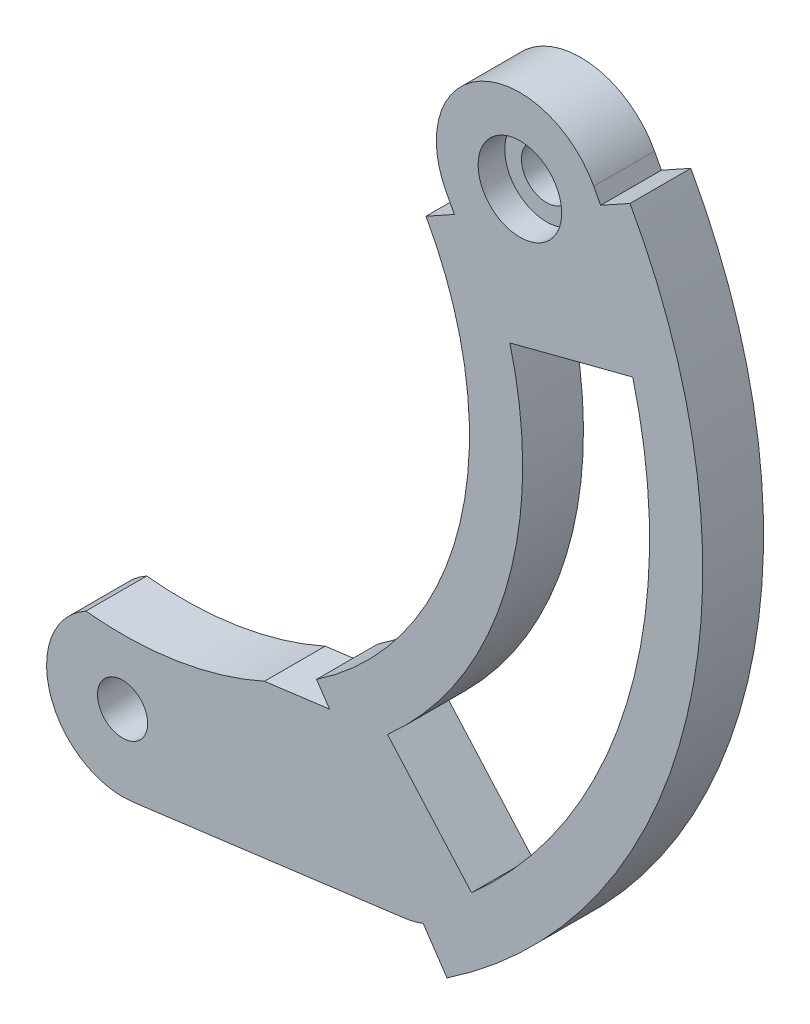
from build123d import *

# Parameters (mm, degrees)
F_01_EIGHT_MILLIMETRE_TRACK_BLANK_DEPTH        = 8
F_02_LOWER_CAGE_TIE_LANDING_DEPTH              = 8
F_03_BUMP_END_SUPPORT_LANDING_DEPTH            = 8
F_04_START                                     = -0.1
S04_RELIEF_FOR_THE_SWEPT_FLOATING_GUID_R       = 45.5
F_04_RELIEF_FOR_THE_SWEPT_FLOATING_GUIDE_DEPTH = 8.2
F_05_START                                     = -0.1
F_05_CONCENTRIC_GUIDE_AND_TANGENT_STOP_F_DEPTH = 8.2
F_06_START                                     = -0.1
S06_SUPPORT_FASTENERS_R                        = 3.3
F_06_SUPPORT_FASTENERS_DEPTH                   = 8.2
F_07_START                                     = -0.1
S07_BUMP_END_SUPPORT_REGISTER_UNDERSID_R       = 5.06
F_07_BUMP_END_SUPPORT_REGISTER_UNDERSIDE_DEPTH = 1.35
F_08_START                                     = 4.5
S08_FLUSH_BUTTON_SCREW_COUNTERBORE_OUT_R       = 5.5
F_08_FLUSH_BUTTON_SCREW_COUNTERBORE_OUTB_DEPTH = 3.6
F_01_START                                     = -0.1
S01_FULL_DIAMETER_LOCATING_SEAT_FOR_PR_R       = 8.15
F_01_FULL_DIAMETER_LOCATING_SEAT_FOR_PRI_DEPTH = 1.35


with BuildPart() as part:
    # S01 - Eight millimetre track blank → 01 - Eight millimetre track blank (new body)
    with BuildSketch(Plane.XY):
        with BuildLine():
            Line((25.527156043, -37.845565187), (42.69437818, -63.297018665))
            ThreePointArc((42.69437818, -63.297018665), (74.240443422, -17.82355353), (66.77721464, 37.015214506))
            Line((66.77721464, 37.015214506), (39.926389631, 22.131559164))
            ThreePointArc((39.926389631, 22.131559164), (44.388686866, -10.65678086), (25.527156043, -37.845565187))
        make_face()
    extrude(amount=F_01_EIGHT_MILLIMETRE_TRACK_BLANK_DEPTH)

    # S02 - Lower cage tie landing → 02 - Lower cage tie landing (add)
    with BuildSketch(Plane.XY):
        with BuildLine():
            Line((-1.286113116, -44.083049206), (34.568787274, -39.433085863))
            ThreePointArc((34.568787274, -39.433085863), (45.771851184, -48.063923541), (37.141013506, -59.266987451))
            Line((37.141013506, -59.266987451), (1.286113116, -63.916950794))
            ThreePointArc((1.286113116, -63.916950794), (-9.916950794, -55.286113116), (-1.286113116, -44.083049206))
        make_face()
    extrude(amount=F_02_LOWER_CAGE_TIE_LANDING_DEPTH)

    # S03 - Bump end support landing → 03 - Bump end support landing (add)
    with BuildSketch(Plane.XY):
        with BuildLine():
            Line((45.572351488, 20.615526776), (42.574781821, 26.253135379))
            ThreePointArc((42.574781821, 26.253135379), (47.123018152, 41.129746091), (61.999628864, 36.58150976))
            Line((61.999628864, 36.58150976), (64.997198531, 30.943901157))
            ThreePointArc((64.997198531, 30.943901157), (60.4489622, 16.067290445), (45.572351488, 20.615526776))
        make_face()
    extrude(amount=F_03_BUMP_END_SUPPORT_LANDING_DEPTH)

    # S04 - Relief for the swept floating guide barrels → 04 - Relief for the swept floating guide barrels (cut)
    with BuildSketch(Plane.XY.offset(F_04_START)):
        Circle(S04_RELIEF_FOR_THE_SWEPT_FLOATING_GUID_R)
    extrude(amount=F_04_RELIEF_FOR_THE_SWEPT_FLOATING_GUIDE_DEPTH, mode=Mode.SUBTRACT)

    # S05 - Concentric guide and tangent stop faces → 05 - Concentric guide and tangent stop faces (cut)
    with BuildSketch(Plane.XY.offset(F_05_START)):
        with BuildLine():
            Line((34.862224899, -39.454375867), (45.92013859, -51.968869257))
            ThreePointArc((45.92013859, -51.968869257), (66.319734826, -20.275977723), (67.130143118, 17.405929591))
            Line((67.130143118, 17.405929591), (50.9647013, 13.214451233))
            ThreePointArc((50.9647013, 13.214451233), (50.349445401, -15.393370254), (34.862224899, -39.454375867))
        make_face()
    extrude(amount=F_05_CONCENTRIC_GUIDE_AND_TANGENT_STOP_F_DEPTH, mode=Mode.SUBTRACT)

    # S06 - Support fasteners → 06 - Support fasteners (cut)
    with BuildSketch(Plane.XY.offset(F_06_START)):
        with Locations(Location((0, -54, 0), (0, 0, 180))):
            Circle(S06_SUPPORT_FASTENERS_R)
        with Locations(Location((52.287205343, 31.41732257, 0), (0, 0, 180))):
            Circle(S06_SUPPORT_FASTENERS_R)
    extrude(amount=F_06_SUPPORT_FASTENERS_DEPTH, mode=Mode.SUBTRACT)

    # S07 - Bump end support register underside → 07 - Bump end support register underside (cut)
    with BuildSketch(Plane.XY.offset(F_07_START)):
        with Locations(Location((52.287205343, 31.41732257, 0), (0, 0, 180))):
            Circle(S07_BUMP_END_SUPPORT_REGISTER_UNDERSID_R)
    extrude(amount=F_07_BUMP_END_SUPPORT_REGISTER_UNDERSIDE_DEPTH, mode=Mode.SUBTRACT)

    # S08 - Flush button screw counterbore outboard → 08 - Flush button screw counterbore outboard (cut)
    with BuildSketch(Plane.XY.offset(F_08_START)):
        with Locations(Location((52.287205343, 31.41732257, 0), (0, 0, 180))):
            Circle(S08_FLUSH_BUTTON_SCREW_COUNTERBORE_OUT_R)
    extrude(amount=F_08_FLUSH_BUTTON_SCREW_COUNTERBORE_OUTB_DEPTH, mode=Mode.SUBTRACT)

    # S01 - Full diameter locating seat for printed post → 01 - Full diameter locating seat for printed post (cut)
    with BuildSketch(Plane.XY.offset(F_01_START)):
        with Locations(Location((52.287205346, 31.41732257, 0), (0, 0, 180))):
            Circle(S01_FULL_DIAMETER_LOCATING_SEAT_FOR_PR_R)
    extrude(amount=F_01_FULL_DIAMETER_LOCATING_SEAT_FOR_PRI_DEPTH, mode=Mode.SUBTRACT)


solid = part.part
